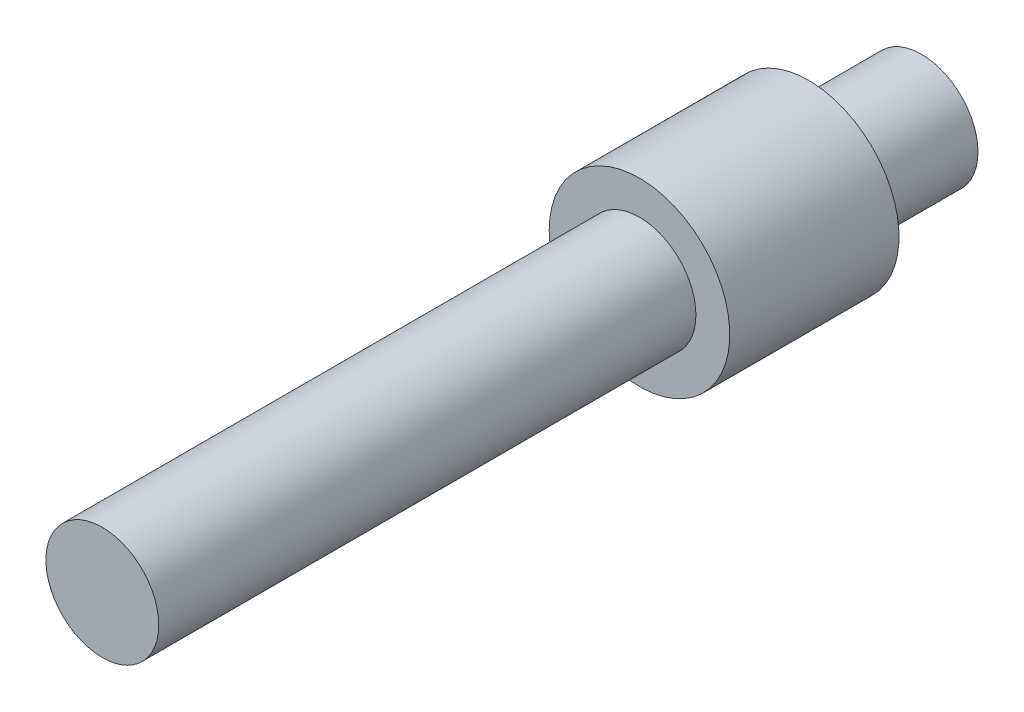
from build123d import *

# Parameters (mm, degrees)
SKETCH1_R           = 6.35
BOSS_EXTRUDE1_DEPTH = 92.202
BOSS_EXTRUDE2_START = -12.7
SKETCH2_R           = 10.16
BOSS_EXTRUDE2_DEPTH = 19.05


with BuildPart() as part:
    # Sketch1 → Boss-Extrude1 (new body)
    with BuildSketch(Plane.XY):
        Circle(SKETCH1_R)
    extrude(amount=-BOSS_EXTRUDE1_DEPTH)

    # Sketch2 → Boss-Extrude2 (add)
    with BuildSketch(Plane(origin=(0, 0, -92.202), x_dir=(-1, 0, 0), z_dir=(0, 0, -1)).offset(BOSS_EXTRUDE2_START)):
        Circle(SKETCH2_R)
    extrude(amount=-BOSS_EXTRUDE2_DEPTH)


solid = part.part
